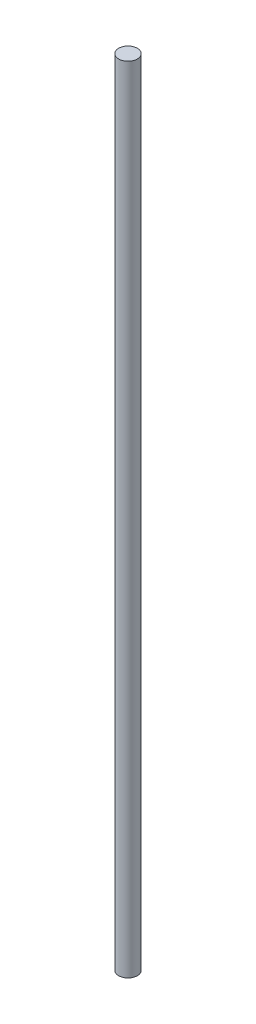
from build123d import *

# Parameters (mm, degrees)
SKETCH1_R           = 0.5969
BOSS_EXTRUDE1_DEPTH = 50.8


with BuildPart() as part:
    # Sketch1 → Boss-Extrude1 (new body)
    with BuildSketch(Plane(origin=(0, 0, 0), x_dir=(1, 0, 0), z_dir=(0, 1, 0))):
        with Locations(Location((0, 0, 0), (0, 0, 270))):
            Circle(SKETCH1_R)
    extrude(amount=BOSS_EXTRUDE1_DEPTH)


solid = part.part
